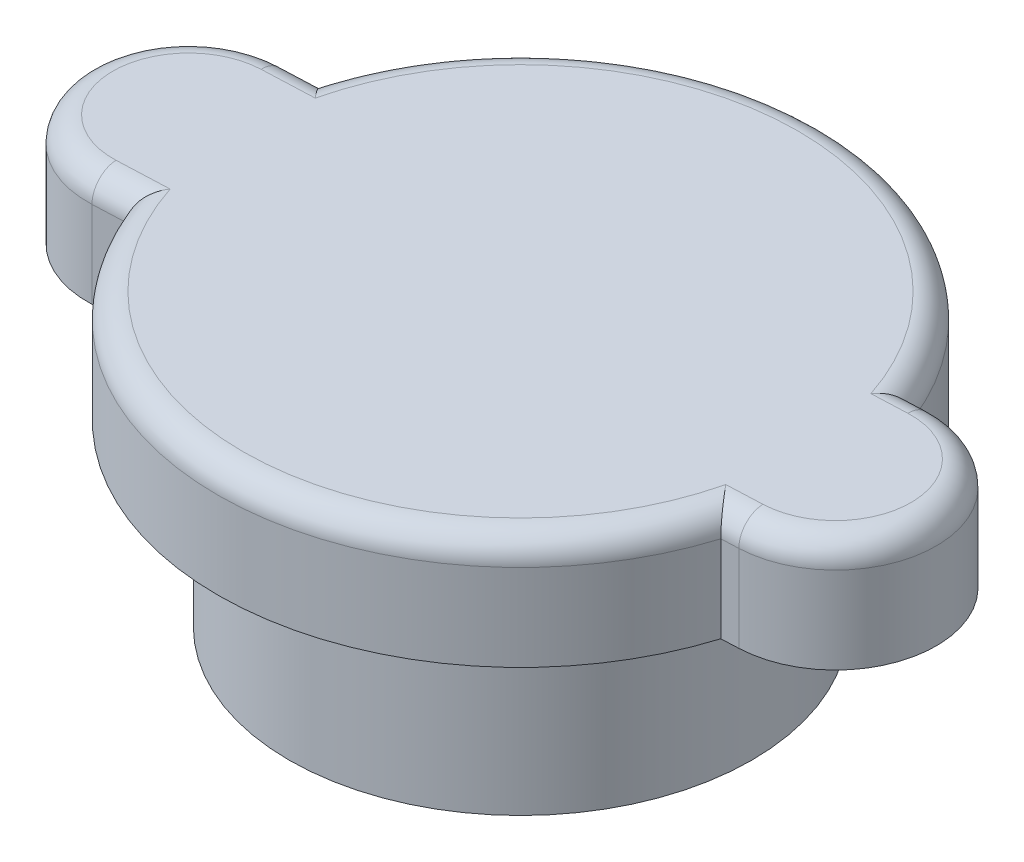
from build123d import *

# Parameters (mm, degrees)
SKETCH11_R = 18.415
NECK_DEPTH = 14.224
SKETCH12_R = 24.098503073
LID_DEPTH  = 8.89
FILLET3_R  = 2


with BuildPart() as part:
    # Sketch11 → neck (new body)
    with BuildSketch(Plane(origin=(0, 0, 0), x_dir=(1, 0, 0), z_dir=(0, 1, 0))):
        with Locations(Location((0, 0, 0), (0, 0, 270))):
            Circle(SKETCH11_R)
    extrude(amount=NECK_DEPTH)

    # Sketch12 → lid (add)
    with BuildSketch(Plane(origin=(0, 14.224, 0), x_dir=(1, 0, 0), z_dir=(0, 1, 0))):
        Circle(SKETCH12_R)
        with BuildLine():
            Line((-25.707660556, 6.978419473), (23.749239481, 9.0074205))
            ThreePointArc((23.749239481, 9.0074205), (32.097843424, 1.316834602), (24.407257526, -7.031769341))
            Line((24.407257526, -7.031769341), (-25.049642512, -9.060770368))
            ThreePointArc((-25.049642512, -9.060770368), (-33.398246454, -1.37018447), (-25.707660556, 6.978419473))
        make_face()
    extrude(amount=LID_DEPTH)

    # Fillet3
    fillet3_edges = [part.edges().sort_by_distance(p)[0] for p in [
        (-24.370076377, 23.114, -7.033294721),
        (23.061856817, 23.114, -8.979220186),
        (-0.98782558, 23.114, -24.078248504),
        (-33.398246454, 23.114, 1.37018447),
        (-23.712058333, 23.114, 9.00589512),
        (0.98782558, 23.114, 24.078248504),
        (23.719874862, 23.114, 7.059969655),
        (32.097843424, 23.114, -1.316834602),
    ]]
    fillet(fillet3_edges, radius=FILLET3_R)


solid = part.part
